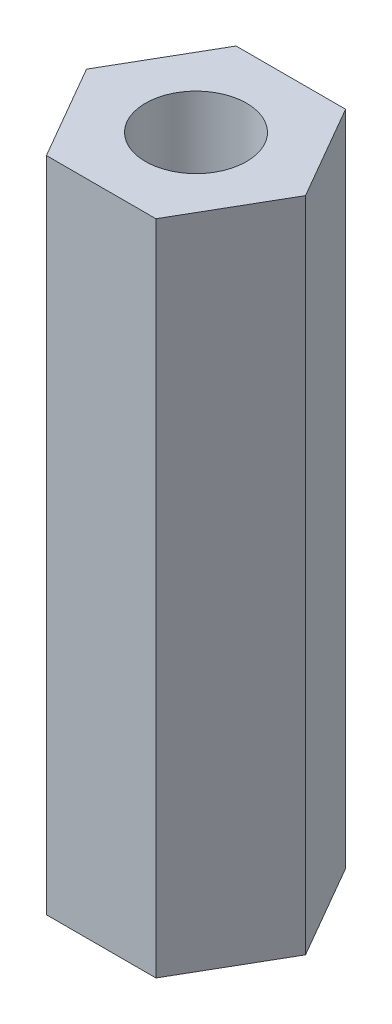
from build123d import *

# Parameters (mm, degrees)
SKETCH1_R           = 2
BOSS_EXTRUDE1_DEPTH = 26


with BuildPart() as part:
    # Sketch1 → Boss-Extrude1 (new body)
    with BuildSketch(Plane(origin=(0, 0, 0), x_dir=(1, 0, 0), z_dir=(0, 1, 0))):
        Polygon((2.165063509, 3.75), (-2.165063509, 3.75), (-4.330127019, 0), (-2.165063509, -3.75), (2.165063509, -3.75), (4.330127019, 0), align=None)
        with Locations(Location((0, 0, 0), (0, 0, 90))):
            Circle(SKETCH1_R, mode=Mode.SUBTRACT)
    extrude(amount=BOSS_EXTRUDE1_DEPTH)


solid = part.part
